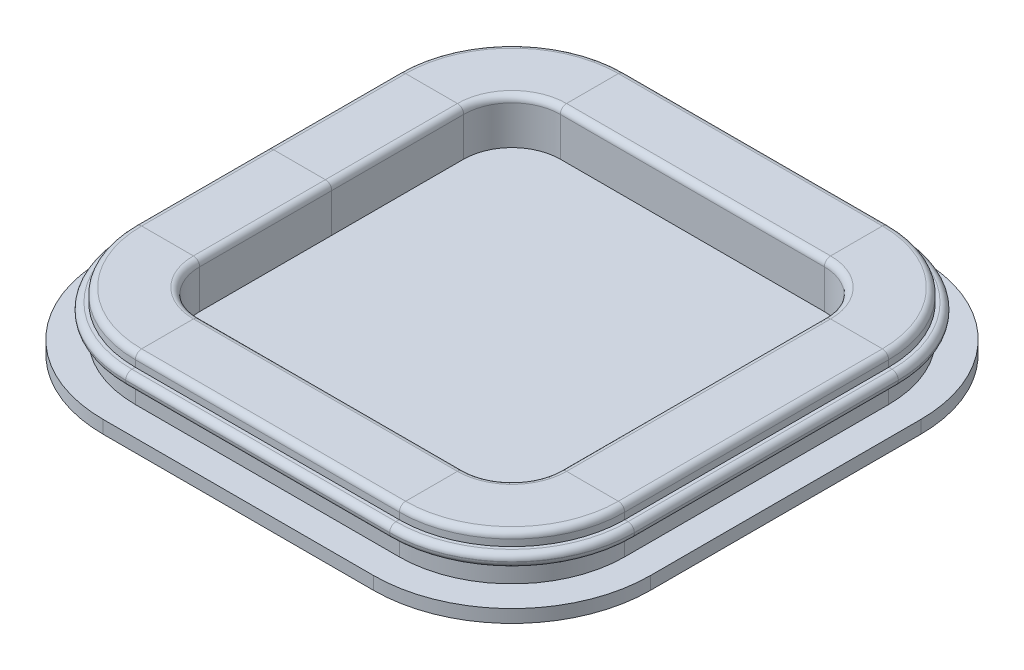
from build123d import *

# Parameters (mm, degrees)
BOSS_EXTRUDE1_DEPTH = 1


with BuildPart() as part:
    # Sketch2 → Boss-Extrude1 (new body)
    with BuildSketch(Plane(origin=(0, 0, 0), x_dir=(1, 0, 0), z_dir=(0, 1, 0))):
        with BuildLine():
            Line((-10.5, -21.25), (10.5, -21.25))
            ThreePointArc((10.5, -21.25), (18.101397898, -18.101397898), (21.25, -10.5))
            Line((21.25, -10.5), (21.25, 10.5))
            ThreePointArc((21.25, 10.5), (18.101397898, 18.101397898), (10.5, 21.25))
            Line((10.5, 21.25), (-10.5, 21.25))
            ThreePointArc((-10.5, 21.25), (-18.101397898, 18.101397898), (-21.25, 10.5))
            Line((-21.25, 10.5), (-21.25, -10.5))
            ThreePointArc((-21.25, -10.5), (-18.101397898, -18.101397898), (-10.5, -21.25))
        make_face()
    extrude(amount=BOSS_EXTRUDE1_DEPTH)

    # Sweep3: sweep along a path in Sketch3
    with BuildLine(Plane(origin=(0, 1, 0), x_dir=(1, 0, 0), z_dir=(0, 1, 0))) as sweep3_path:
        Line((10.25, 19), (-10.25, 19))
        ThreePointArc((-10.25, 19), (-16.437184335, 16.437184335), (-19, 10.25))
        Line((-19, 10.25), (-19, -10.25))
        ThreePointArc((-19, -10.25), (-16.437184335, -16.437184335), (-10.25, -19))
        Line((-10.25, -19), (10.25, -19))
        ThreePointArc((10.25, -19), (16.437184335, -16.437184335), (19, -10.25))
        Line((19, -10.25), (19, 10.25))
        ThreePointArc((19, 10.25), (16.437184335, 16.437184335), (10.25, 19))
    # Sketch11 → Sweep3 (sweep)
    with BuildSketch(Plane.XY):
        with BuildLine():
            Line((-14, 1), (-19, 1))
            Line((-19, 1), (-19, 2.5))
            Line((-19, 2.5), (-19.26, 2.5))
            ThreePointArc((-19.26, 2.5), (-19.606482323, 2.643517677), (-19.75, 2.99))
            Line((-19.75, 2.99), (-19.75, 3.01))
            ThreePointArc((-19.75, 3.01), (-19.606482323, 3.356482323), (-19.26, 3.5))
            Line((-19.26, 3.5), (-19, 3.5))
            Line((-19, 3.5), (-19, 4.01))
            ThreePointArc((-19, 4.01), (-18.856482323, 4.356482323), (-18.51, 4.5))
            Line((-18.51, 4.5), (-14.49, 4.5))
            ThreePointArc((-14.49, 4.5), (-14.143517677, 4.356482323), (-14, 4.01))
            Line((-14, 4.01), (-14, 1))
        make_face()
    sweep(path=sweep3_path.line)


solid = part.part
